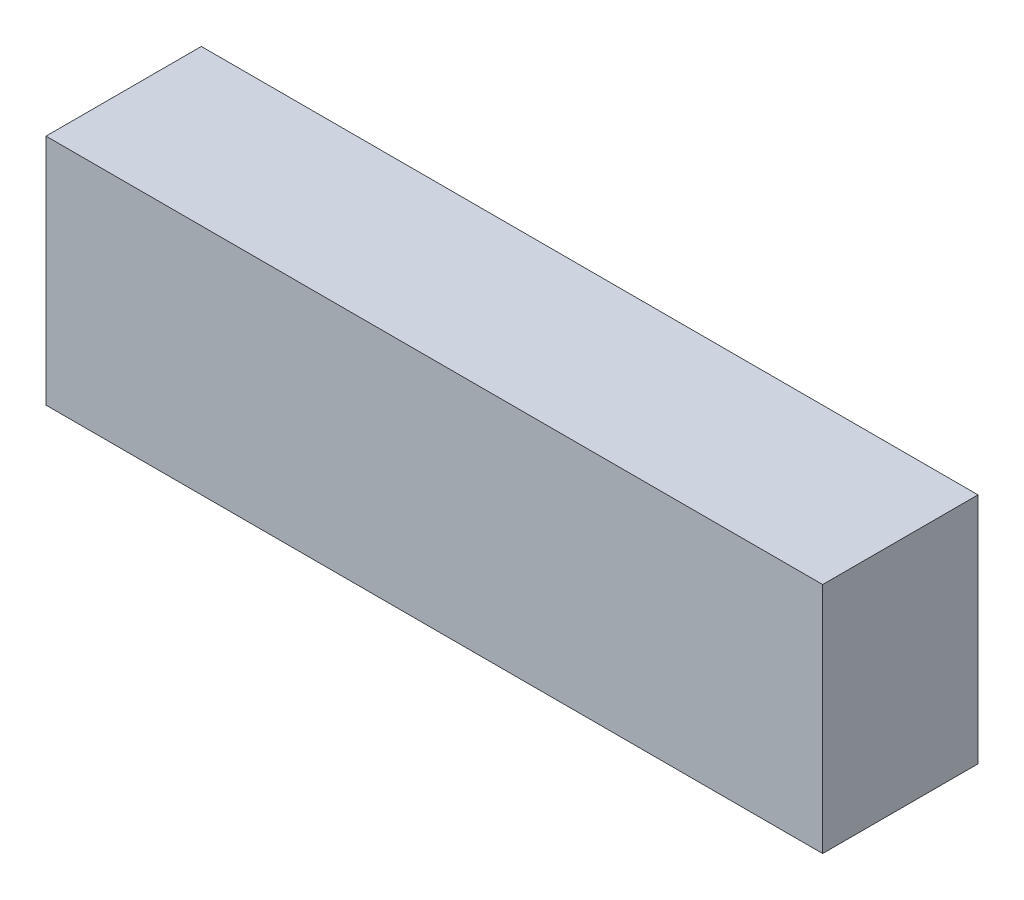
from build123d import *

# Parameters (mm, degrees)
SKETCH_1_W      = 60
SKETCH_1_H      = 18
EXTRUDE_1_DEPTH = 12


with BuildPart() as part:
    # 草图1 → 凸台-拉伸1 (new body)
    with BuildSketch(Plane.XY):
        Rectangle(SKETCH_1_W, SKETCH_1_H)
    extrude(amount=EXTRUDE_1_DEPTH)


solid = part.part
